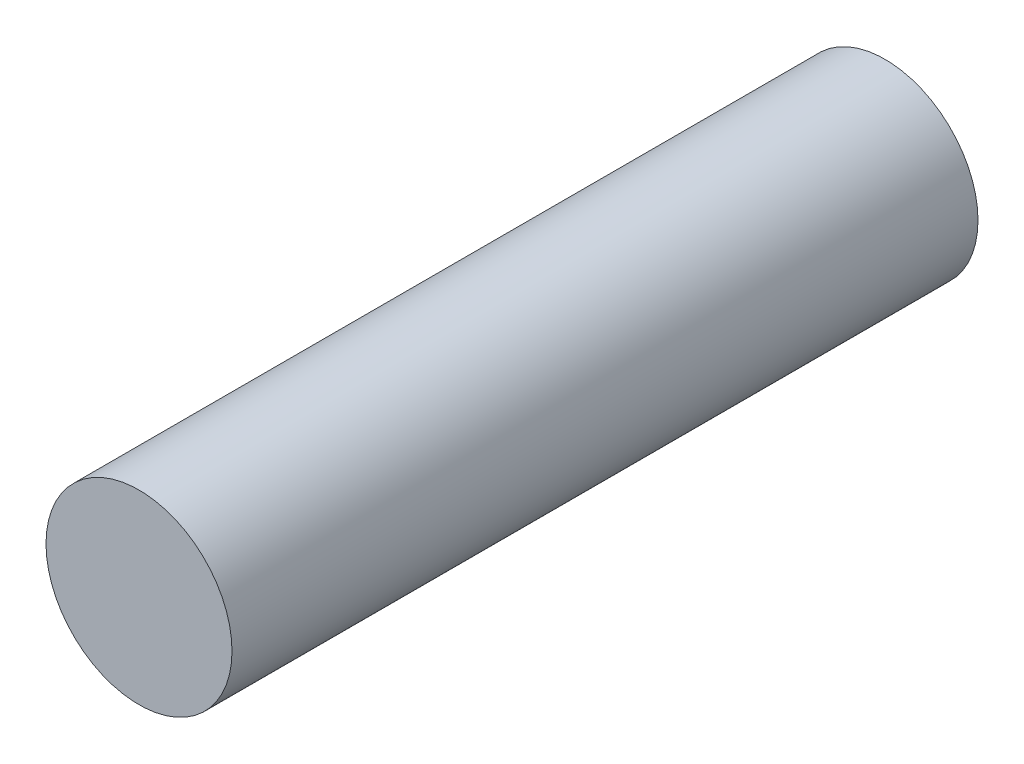
from build123d import *

# Parameters (mm, degrees)
SKETCH2_R           = 0.0935
BOSS_EXTRUDE1_DEPTH = 0.75


with BuildPart() as part:
    # Sketch2 → Boss-Extrude1 (new body)
    with BuildSketch(Plane.XY):
        Circle(SKETCH2_R)
    extrude(amount=BOSS_EXTRUDE1_DEPTH)


solid = part.part
